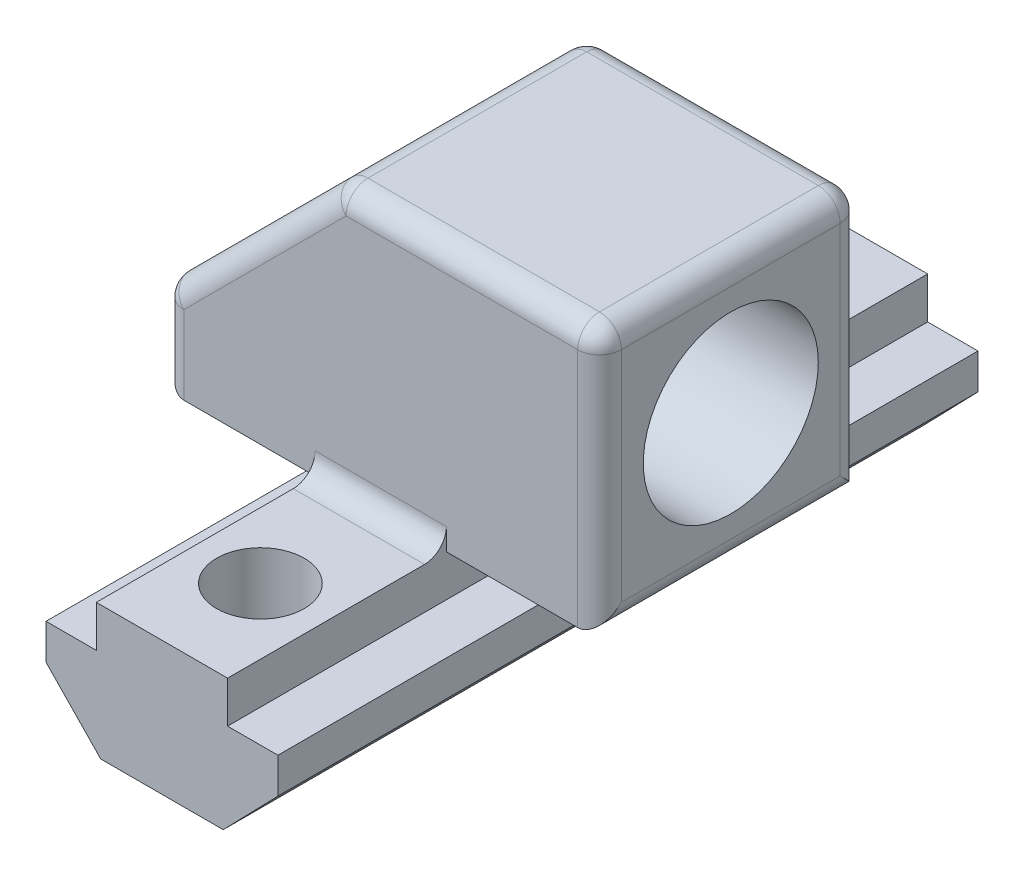
from build123d import *

# Parameters (mm, degrees)
BOSS_EXTRUDE1_DEPTH     = 16
SKETCH2_W               = 20
SKETCH2_H               = 11.997864578
BOSS_EXTRUDE2_DEPTH     = 12
CHAMFER1_SIZE           = 8
FILLET1_R               = 1
CUT_EXTRUDE1_DEPTH      = 27.145936587
CUT_EXTRUDE1_DEPTH_BACK = 27.145936587
SKETCH3_R               = 4
SKETCH4_R               = 2
CUT_EXTRUDE2_DEPTH      = 23.36067982


with BuildPart() as part:
    # Sketch1 → Boss-Extrude1 (new, symmetric)
    with BuildSketch(Plane.XY):
        Polygon((-3, 6.1), (3, 6.1), (3, 4.2), (5.3, 4.2), (5.3, 2.58), (2.8, 0), (-2.8, 0), (-5.3, 2.58), (-5.3, 4.2), (-3, 4.2), align=None)
    extrude(amount=BOSS_EXTRUDE1_DEPTH, both=True)

    # Sketch2 → Boss-Extrude2 (add)
    with BuildSketch(Plane(origin=(0, 6.1, 0), x_dir=(1, 0, 0), z_dir=(0, 1, 0))):
        Rectangle(SKETCH2_W, SKETCH2_H)
    extrude(amount=BOSS_EXTRUDE2_DEPTH)

    # Chamfer1
    chamfer1_edges = [part.edges().sort_by_distance(p)[0] for p in [
        (-10, 18.1, 0),
    ]]
    chamfer(chamfer1_edges, length=CHAMFER1_SIZE)

    # Fillet1
    fillet1_edges = [part.edges().sort_by_distance(p)[0] for p in [
        (0, 6.1, -5.998932289),
        (0, 6.1, 5.998932289),
        (-10, 6.1, 0),
        (-10, 8.1, 5.998932289),
        (-10, 8.1, -5.998932289),
        (10, 6.1, 0),
        (-6, 14.1, 5.998932289),
        (-6, 14.1, -5.998932289),
        (4, 18.1, -5.998932289),
        (4, 18.1, 5.998932289),
        (10, 12.1, -5.998932289),
        (10, 18.1, 0),
        (10, 12.1, 5.998932289),
        (-2, 18.1, 0),
        (-10, 10.1, 0),
    ]]
    fillet(fillet1_edges, radius=FILLET1_R)

    # Sketch3 → Cut-Extrude1 (cut, two sides: drawn at the far end of the back side and taken through both)
    with BuildSketch(Plane(origin=(0, 0, 0), x_dir=(0, 0, -1), z_dir=(1, 0, 0)).offset(-CUT_EXTRUDE1_DEPTH_BACK)):
        with Locations((0, 12.1)):
            Circle(SKETCH3_R)
    extrude(amount=CUT_EXTRUDE1_DEPTH + CUT_EXTRUDE1_DEPTH_BACK, mode=Mode.SUBTRACT)

    # Sketch4 → Cut-Extrude2 (cut, through all)
    with BuildSketch(Plane(origin=(0, 6.1, 0), x_dir=(1, 0, 0), z_dir=(0, 1, 0))):
        with Locations(Location((0, 11.5, 0), (0, 0, 270))):
            Circle(SKETCH4_R)
        with Locations(Location((0, -11.5, 0), (0, 0, 270))):
            Circle(SKETCH4_R)
    extrude(amount=-CUT_EXTRUDE2_DEPTH, mode=Mode.SUBTRACT)


solid = part.part
